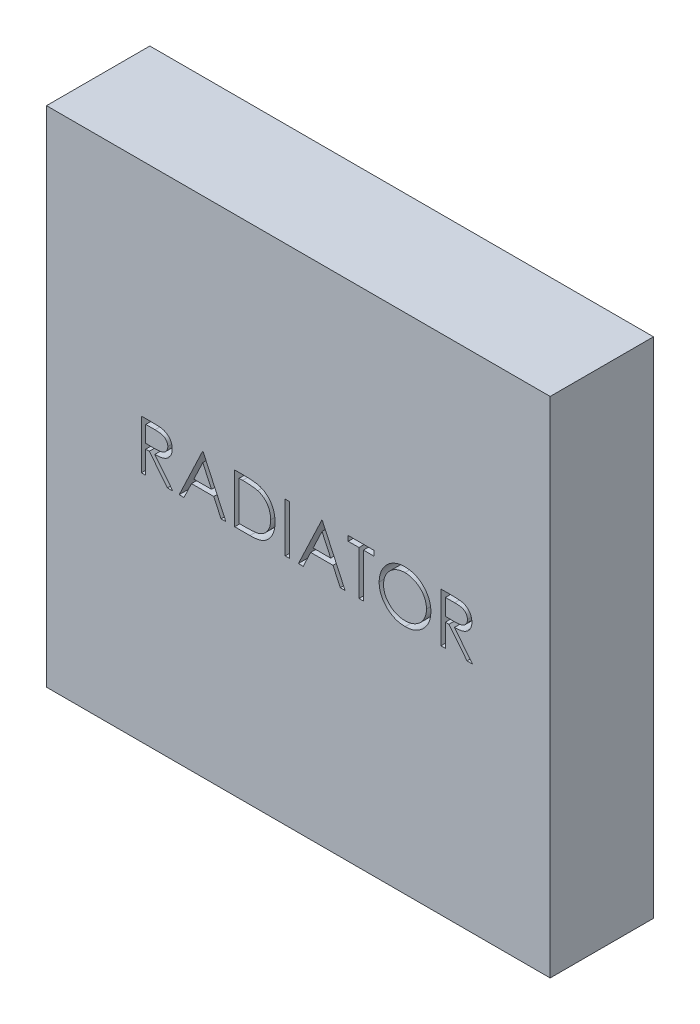
from build123d import *

# Parameters (mm, degrees)
BOSS_EXTRUDE1_DEPTH      = 97.5
BOSS_EXTRUDE1_DEPTH_BACK = 97.5
SKETCH1_W                = 195
SKETCH1_H                = 40
SKETCH2_W                = 1.709615385
SKETCH2_H                = 19.05
CUT_EXTRUDE1_DEPTH       = 15


with BuildPart() as part:
    # Sketch1 → Boss-Extrude1 (new, two sides: drawn at the far end of the back side and taken through both)
    with BuildSketch(Plane(origin=(0, 0, 0), x_dir=(1, 0, 0), z_dir=(0, 1, 0)).offset(-BOSS_EXTRUDE1_DEPTH_BACK)):
        Rectangle(SKETCH1_W, SKETCH1_H)
    extrude(amount=BOSS_EXTRUDE1_DEPTH + BOSS_EXTRUDE1_DEPTH_BACK)

    # Sketch2 → Cut-Extrude1 (cut)
    # profile 1 of 8: a face of its own
    with BuildSketch(Plane.XY.offset(20)):
        with BuildLine():
            Line((-60.79016225, 11.780573711), (-56.977872587, 11.780573711))
            add(Edge.make_bspline(
                [(-56.977872587, 11.780573711), (-56.723467302, 11.779726879), (-56.234980973, 11.778100867), (-55.53517503, 11.769034357), (-54.899301831, 11.743048221), (-54.327693848, 11.720685788), (-53.820361569, 11.679908222), (-53.375749315, 11.640933843), (-52.995904847, 11.589914346), (-52.765966713, 11.542531973), (-52.661856962, 11.521078519)],
                knots=[0, 0, 0, 0, 1.410062039, 2.707475311, 3.878576406, 4.937260626, 5.877586885, 6.699081471, 7.410979367, 8, 8, 8, 8], degree=3))
            add(Edge.make_bspline(
                [(-52.661856962, 11.521078519), (-52.522483765, 11.486642839), (-52.246710579, 11.418506085), (-51.849653791, 11.274490258), (-51.471297257, 11.107832015), (-51.113212641, 10.912086623), (-50.777193549, 10.685801037), (-50.459775315, 10.432881684), (-50.159517578, 10.154712464), (-49.888563277, 9.84427997), (-49.633080724, 9.518598396), (-49.417605486, 9.166425091), (-49.231859932, 8.798153062), (-49.083974689, 8.410036974), (-48.964896005, 8.005840759), (-48.880933188, 7.581903165), (-48.830580295, 7.140155572), (-48.82545391, 6.838850383), (-48.822854558, 6.686072509)],
                knots=[0, 0, 0, 0, 1.027469482, 2.033020251, 3.019912614, 3.986113645, 4.951240523, 5.91722682, 6.890402269, 7.87763091, 8.8651537, 9.85103654, 10.82876324, 11.815024772, 12.821070561, 13.842952187, 14.906261191, 16, 16, 16, 16], degree=3))
            add(Edge.make_bspline(
                [(-48.822854558, 6.686072509), (-48.830850105, 6.432244297), (-48.846451488, 5.936959712), (-48.991912409, 5.2181712), (-49.230181752, 4.547669359), (-49.558512797, 3.92629843), (-49.976630229, 3.366170488), (-50.479140878, 2.874188153), (-51.066325077, 2.462490915), (-51.612947497, 2.176997792), (-52.095806212, 1.994156389), (-52.493316101, 1.865507065), (-52.926932078, 1.766109796), (-53.392499571, 1.677063936), (-53.891956038, 1.609835428), (-54.424104396, 1.560596107), (-54.989324164, 1.529821927), (-55.377612527, 1.525239015), (-55.57736177, 1.522881403)],
                knots=[0, 0, 0, 0, 1.260483769, 2.459530307, 3.627416485, 4.787058657, 5.939039949, 7.08810263, 8.267026773, 9.491475466, 10.141966685, 10.831826277, 11.566392101, 12.351337768, 13.187381173, 14.07005841, 15.007169909, 16, 16, 16, 16], degree=3))
            Line((-55.57736177, 1.522881403), (-48.578623789, -7.269426289))
            Line((-48.578623789, -7.269426289), (-50.692746385, -7.269426289))
            Line((-50.692746385, -7.269426289), (-57.691484366, 1.522881403))
            Line((-57.691484366, 1.522881403), (-59.080546866, 1.522881403))
            Line((-59.080546866, 1.522881403), (-59.080546866, -7.269426289))
            Line((-59.080546866, -7.269426289), (-60.79016225, -7.269426289))
            Line((-60.79016225, -7.269426289), (-60.79016225, 11.780573711))
        make_face()
        with BuildLine():
            Line((-59.080546866, 9.826727557), (-59.080546866, 3.476727557))
            Line((-59.080546866, 3.476727557), (-55.592626193, 3.450014817))
            add(Edge.make_bspline(
                [(-55.592626193, 3.450014817), (-55.429775695, 3.449942772), (-55.114125049, 3.449803127), (-54.657465716, 3.471540681), (-54.232269108, 3.496269313), (-53.840161585, 3.534093608), (-53.480967983, 3.582840227), (-53.154867833, 3.64381647), (-52.861328822, 3.714856982), (-52.518981063, 3.824811546), (-52.136693657, 3.999015731), (-51.721232425, 4.252465088), (-51.367433987, 4.571248436), (-51.068523908, 4.93577539), (-50.828333716, 5.336566973), (-50.658995249, 5.768818925), (-50.551539956, 6.221618909), (-50.538866016, 6.532831182), (-50.532469943, 6.689888615)],
                knots=[0, 0, 0, 0, 1.146690395, 2.22261258, 3.21895312, 4.145990853, 4.996080663, 5.770904154, 6.481378293, 7.121626537, 8.300444488, 9.431385265, 10.535395872, 11.636531494, 12.74115979, 13.810798291, 14.895190096, 16, 16, 16, 16], degree=3))
            add(Edge.make_bspline(
                [(-50.532469943, 6.689888615), (-50.539012916, 6.843086395), (-50.551978702, 7.146668494), (-50.65783557, 7.591109948), (-50.836847775, 8.010574348), (-51.078087384, 8.403355331), (-51.37199707, 8.759893693), (-51.716626879, 9.064950341), (-52.102553727, 9.31667957), (-52.463258393, 9.477539841), (-52.785661749, 9.576163614), (-53.065586042, 9.645566377), (-53.381878513, 9.701325557), (-53.736074938, 9.74600086), (-54.126663243, 9.784399914), (-54.555618358, 9.810263166), (-55.020094262, 9.825578627), (-55.342022559, 9.826335668), (-55.508671866, 9.826727557)],
                knots=[0, 0, 0, 0, 1.101028733, 2.181837193, 3.264309656, 4.369019818, 5.486613113, 6.575447106, 7.666700264, 8.788928104, 9.402425223, 10.0903467, 10.862060571, 11.710948788, 12.657782767, 13.684531032, 14.801375019, 16, 16, 16, 16], degree=3))
            Line((-55.508671866, 9.826727557), (-59.080546866, 9.826727557))
        make_face(mode=Mode.SUBTRACT)
    # profile 2 of 8: a face of its own
    with BuildSketch(Plane.XY.offset(20)):
        Polygon((-36.855546866, 11.780573711), (-28.063239173, -7.269426289), (-29.921682683, -7.269426289), (-32.737968741, -1.163657058), (-41.373816097, -1.163657058), (-44.270240375, -7.269426289), (-46.136316097, -7.269426289), (-37.099777635, 11.780573711), align=None)
        Polygon((-36.996742779, 8.067502798), (-40.446502395, 0.790189096), (-33.638569702, 0.790189096), align=None, mode=Mode.SUBTRACT)
    # profile 3 of 8: a face of its own
    with BuildSketch(Plane.XY.offset(20)):
        with BuildLine():
            Line((-24.644008404, -7.269426289), (-24.644008404, 11.780573711))
            Line((-24.644008404, 11.780573711), (-20.797373789, 11.780573711))
            add(Edge.make_bspline(
                [(-20.797373789, 11.780573711), (-20.462806867, 11.778164866), (-19.816425316, 11.773510989), (-18.882363281, 11.744003132), (-18.018125945, 11.691803596), (-17.226555669, 11.615769461), (-16.505479358, 11.522407949), (-15.856916077, 11.40538432), (-15.277512271, 11.267200136), (-14.921171458, 11.149387042), (-14.75266225, 11.093674673)],
                knots=[0, 0, 0, 0, 1.314313732, 2.53924729, 3.670748893, 4.714932338, 5.66265055, 6.526160246, 7.303039223, 8, 8, 8, 8], degree=3))
            add(Edge.make_bspline(
                [(-14.75266225, 11.093674673), (-14.532255169, 11.009687546), (-14.096439108, 10.843617843), (-13.475914627, 10.530347117), (-12.891758009, 10.17540152), (-12.340836663, 9.778313182), (-11.835735022, 9.327838656), (-11.356720613, 8.843113662), (-10.923389045, 8.30651141), (-10.526559605, 7.729160404), (-10.168769801, 7.117861948), (-9.857769528, 6.473780857), (-9.599484221, 5.800188053), (-9.385072516, 5.098956747), (-9.216091083, 4.368545034), (-9.100800855, 3.60810242), (-9.024758753, 2.820634261), (-9.017116702, 2.286284679), (-9.013239173, 2.015159048)],
                knots=[0, 0, 0, 0, 0.984719456, 1.947108742, 2.898477687, 3.838006223, 4.779231079, 5.722358779, 6.681677486, 7.655904652, 8.64651281, 9.637519902, 10.640069247, 11.656948941, 12.698408672, 13.768548281, 14.867775369, 16, 16, 16, 16], degree=3))
            add(Edge.make_bspline(
                [(-9.013239173, 2.015159048), (-9.016662554, 1.779694307), (-9.023408682, 1.315686441), (-9.083983958, 0.631840995), (-9.172029357, -0.031717158), (-9.308341348, -0.671828182), (-9.473817886, -1.29410034), (-9.685894195, -1.891901555), (-9.928838824, -2.470715717), (-10.212138877, -3.022716551), (-10.523151273, -3.54568462), (-10.856916761, -4.03867428), (-11.213079346, -4.494650845), (-11.595035291, -4.914995147), (-11.997848719, -5.29907351), (-12.424156861, -5.650094336), (-12.875059752, -5.961189299), (-13.348537828, -6.244583131), (-13.858403617, -6.491799637), (-14.414314546, -6.700968691), (-15.018641386, -6.874305269), (-15.66990078, -7.018926858), (-16.369217995, -7.133647606), (-17.117278652, -7.210535542), (-17.912933414, -7.26253079), (-18.459283415, -7.267083159), (-18.740492779, -7.269426289)],
                knots=[0, 0, 0, 0, 1.105936401, 2.179363191, 3.223086493, 4.248585256, 5.251745608, 6.245858792, 7.225916811, 8.198733463, 9.158002045, 10.082870192, 10.993790845, 11.873723703, 12.748670949, 13.606408763, 14.465103618, 15.319838547, 16.196477973, 17.123216899, 18.106603292, 19.147568657, 20.255746949, 21.433717677, 22.679120308, 24, 24, 24, 24], degree=3))
            Line((-18.740492779, -7.269426289), (-24.644008404, -7.269426289))
        make_face()
        with BuildLine():
            Line((-22.93439302, -5.315580135), (-20.747764414, -5.315580135))
            add(Edge.make_bspline(
                [(-20.747764414, -5.315580135), (-20.433557139, -5.314229782), (-19.829221479, -5.311632558), (-18.960225808, -5.28884221), (-18.166225093, -5.251602522), (-17.447106592, -5.199486741), (-16.803276331, -5.130533278), (-16.233388778, -5.05365345), (-15.739312015, -4.95787304), (-15.440338937, -4.871054247), (-15.302181481, -4.830934702)],
                knots=[0, 0, 0, 0, 1.375205317, 2.645023457, 3.804390687, 4.853969522, 5.800190428, 6.637939096, 7.370582563, 8, 8, 8, 8], degree=3))
            add(Edge.make_bspline(
                [(-15.302181481, -4.830934702), (-15.12829111, -4.769694078), (-14.784663737, -4.648675561), (-14.290010973, -4.427926005), (-13.828690705, -4.166439883), (-13.392663282, -3.875778934), (-12.988113914, -3.545691409), (-12.610248367, -3.183355027), (-12.259827419, -2.786925751), (-11.940471543, -2.356895615), (-11.654676345, -1.895941156), (-11.40718294, -1.408594075), (-11.190276746, -0.900194151), (-11.020031835, -0.362934302), (-10.886597013, 0.19838243), (-10.792083497, 0.783795534), (-10.733220496, 1.393195682), (-10.726354615, 1.807680816), (-10.722854558, 2.018975153)],
                knots=[0, 0, 0, 0, 0.998632004, 1.973411704, 2.929992603, 3.868527914, 4.809262121, 5.754881198, 6.702106254, 7.672490631, 8.653608572, 9.636854334, 10.631411391, 11.644891563, 12.686317036, 13.754757253, 14.855430412, 16, 16, 16, 16], degree=3))
            add(Edge.make_bspline(
                [(-10.722854558, 2.018975153), (-10.725648308, 2.241770239), (-10.731136654, 2.679453157), (-10.800121115, 3.321659655), (-10.900931296, 3.939318625), (-11.046711073, 4.532471374), (-11.23248057, 5.102275119), (-11.46431712, 5.645578453), (-11.729202577, 6.168119239), (-12.044362167, 6.657836859), (-12.389524183, 7.120986496), (-12.772580926, 7.545283965), (-13.187446593, 7.931695799), (-13.629596273, 8.286239772), (-14.111491056, 8.594652065), (-14.621779002, 8.870532429), (-15.167946155, 9.104661781), (-15.547926685, 9.229188162), (-15.741033645, 9.292472749)],
                knots=[0, 0, 0, 0, 1.122418816, 2.205001699, 3.251619955, 4.274784885, 5.280384055, 6.268708349, 7.249350384, 8.229342522, 9.199999885, 10.157847722, 11.105861043, 12.055065948, 13.010012805, 13.98527497, 14.976112212, 16, 16, 16, 16], degree=3))
            add(Edge.make_bspline(
                [(-15.741033645, 9.292472749), (-15.900787741, 9.336649307), (-16.240468783, 9.430580789), (-16.794766437, 9.533044602), (-17.418600322, 9.623420518), (-18.114740123, 9.699936418), (-18.882392308, 9.754840267), (-19.722147267, 9.796049851), (-20.634367972, 9.823844522), (-21.266732906, 9.825742485), (-21.594939895, 9.826727557)],
                knots=[0, 0, 0, 0, 0.674548936, 1.434276114, 2.292660221, 3.240891867, 4.284742987, 5.42552168, 6.663806718, 8, 8, 8, 8], degree=3))
            Line((-21.594939895, 9.826727557), (-22.93439302, 9.826727557))
            Line((-22.93439302, 9.826727557), (-22.93439302, -5.315580135))
        make_face(mode=Mode.SUBTRACT)
    # profile 4 of 8: a face of its own
    with BuildSketch(Plane.XY.offset(20)):
        with Locations((-4.250739174, 2.255573711)):
            Rectangle(SKETCH2_W, SKETCH2_H)
    # profile 5 of 8: a face of its own
    with BuildSketch(Plane.XY.offset(20)):
        Polygon((9.304068519, 11.780573711), (18.096376211, -7.269426289), (16.237932702, -7.269426289), (13.421646644, -1.163657058), (4.785799288, -1.163657058), (1.889375009, -7.269426289), (0.023299288, -7.269426289), (9.05983775, 11.780573711), align=None)
        Polygon((9.162872605, 8.067502798), (5.71311299, 0.790189096), (12.521045682, 0.790189096), align=None, mode=Mode.SUBTRACT)
    # profile 6 of 8: a face of its own
    with BuildSketch(Plane.XY.offset(20)):
        Polygon((19.317530057, 9.826727557), (19.317530057, 11.780573711), (29.330991596, 11.780573711), (29.330991596, 9.826727557), (25.179068519, 9.826727557), (25.179068519, -7.269426289), (23.469453134, -7.269426289), (23.469453134, 9.826727557), align=None)
    # profile 7 of 8: a face of its own
    with BuildSketch(Plane.XY.offset(20)):
        with BuildLine():
            add(Edge.make_bspline(
                [(41.176183903, 12.269035249), (41.528925166, 12.260100912), (42.221738107, 12.242553135), (43.239960051, 12.1082283), (44.212027641, 11.875843392), (45.145859396, 11.566346302), (46.030285454, 11.153481718), (46.871962855, 10.654452554), (47.668888982, 10.064030685), (48.410322502, 9.386780179), (49.088812474, 8.64990738), (49.686579084, 7.863534755), (50.187552139, 7.032416989), (50.598954781, 6.15905161), (50.921708642, 5.245413785), (51.144425152, 4.286632713), (51.286691369, 3.288920585), (51.303323529, 2.608417221), (51.311760827, 2.263205923)],
                knots=[0, 0, 0, 0, 1.065120563, 2.091984664, 3.0946048, 4.079830382, 5.057816894, 6.036188127, 7.030412546, 8.04752943, 9.064399622, 10.05169764, 11.02544977, 11.989514704, 12.962713494, 13.945757189, 14.957906945, 16, 16, 16, 16], degree=3))
            add(Edge.make_bspline(
                [(51.311760827, 2.263205923), (51.303324765, 1.920537536), (51.286696311, 1.245098448), (51.144263393, 0.253717701), (50.920883093, -0.699275947), (50.601951988, -1.612291571), (50.192510455, -2.486292311), (49.688201595, -3.318978446), (49.094161576, -4.110622958), (48.41812143, -4.852553322), (47.681152901, -5.532896698), (46.890685306, -6.125726579), (46.064495951, -6.6358536), (45.19195311, -7.042890454), (44.284628624, -7.368220478), (43.33440198, -7.590031221), (42.345725736, -7.733107842), (41.671513558, -7.749537193), (41.328828134, -7.757887827)],
                knots=[0, 0, 0, 0, 1.043624062, 2.057103931, 3.04512605, 4.022047818, 4.998200453, 5.980619268, 6.982898556, 8.009068085, 9.034988726, 10.034168286, 11.015286542, 11.987931943, 12.962482838, 13.94673481, 14.956375938, 16, 16, 16, 16], degree=3))
            add(Edge.make_bspline(
                [(41.328828134, -7.757887827), (40.983618627, -7.749454736), (40.303118794, -7.732830868), (39.30415293, -7.590329222), (38.344698353, -7.367491554), (37.427498813, -7.049033052), (36.552042839, -6.637459267), (35.716618246, -6.135604004), (34.924578316, -5.540116564), (34.182489667, -4.864295637), (33.503497603, -4.128576189), (32.911535858, -3.34026403), (32.409567741, -2.514825044), (31.999375889, -1.64996852), (31.67463076, -0.749875382), (31.45308025, 0.191458474), (31.309737425, 1.168666356), (31.293219189, 1.834016988), (31.28483775, 2.171619384)],
                knots=[0, 0, 0, 0, 1.053102029, 2.075944431, 3.073151272, 4.055350789, 5.033113405, 6.020478099, 7.024410459, 8.052272461, 9.079885166, 10.07527673, 11.055994387, 12.023226415, 12.992069828, 13.970394897, 14.97016774, 16, 16, 16, 16], degree=3))
            add(Edge.make_bspline(
                [(31.28483775, 2.171619384), (31.287747694, 2.398220055), (31.293530873, 2.848562727), (31.363154228, 3.517308079), (31.464182916, 4.175298659), (31.608973326, 4.82066339), (31.798339399, 5.451822464), (32.02177972, 6.073128759), (32.294683735, 6.678285884), (32.603188405, 7.27016063), (32.947513389, 7.839526518), (33.327837111, 8.377713963), (33.730801045, 8.889239103), (34.172561802, 9.360846367), (34.638559882, 9.806255268), (35.136354768, 10.218620913), (35.662908984, 10.601661718), (36.220488223, 10.946849574), (36.795353405, 11.25904715), (37.387954152, 11.526954653), (37.990242063, 11.756893931), (38.605038075, 11.943261851), (39.230709592, 12.090393361), (39.868622162, 12.190581957), (40.518267582, 12.260382888), (40.955934904, 12.26613872), (41.176183903, 12.269035249)],
                knots=[0, 0, 0, 0, 1.037015668, 2.060948919, 3.074880161, 4.083647147, 5.086022904, 6.090072063, 7.104153813, 8.122640571, 9.144368836, 10.147691507, 11.138137339, 12.123020368, 13.103399296, 14.087645067, 15.080126199, 16.082011238, 17.087798457, 18.072939717, 19.057185487, 20.037253025, 21.01195951, 21.997135196, 22.992090687, 24, 24, 24, 24], degree=3))
        make_face()
        with BuildLine():
            add(Edge.make_bspline(
                [(41.26013823, 10.315189096), (41.079355725, 10.312985336), (40.719519007, 10.308598884), (40.184570317, 10.250819061), (39.656657077, 10.168469237), (39.135670263, 10.051004102), (38.623789745, 9.890962044), (38.116244181, 9.706770815), (37.617661845, 9.482410307), (37.129688704, 9.228921731), (36.656622367, 8.948348319), (36.210238949, 8.63825913), (35.789382844, 8.305926142), (35.395084492, 7.95057377), (35.028501684, 7.570392366), (34.682419237, 7.171145535), (34.370709086, 6.741421671), (34.085037589, 6.292873599), (33.829398344, 5.826085564), (33.602075485, 5.345971885), (33.416125666, 4.84861619), (33.264474732, 4.339414275), (33.138745761, 3.819172602), (33.059095403, 3.283944625), (33.000680704, 2.736419801), (32.996544974, 2.366404281), (32.994453134, 2.179251596)],
                knots=[0, 0, 0, 0, 1.008559885, 2.007477868, 2.99961109, 3.989939068, 4.984837346, 5.991145699, 7.001802488, 8.033829008, 9.059044045, 10.069351652, 11.065060232, 12.050310815, 13.029377138, 14.011219647, 14.996725999, 15.989392538, 16.977580475, 17.965360261, 18.951710183, 19.937753436, 20.929683414, 21.935841486, 22.955955122, 24, 24, 24, 24], degree=3))
            add(Edge.make_bspline(
                [(32.994453134, 2.179251596), (33.001392026, 1.904048651), (33.015042972, 1.362639322), (33.134554889, 0.569244139), (33.318643065, -0.193236391), (33.590009588, -0.920630212), (33.929375076, -1.619189808), (34.348621436, -2.282718207), (34.845331602, -2.911394737), (35.409557368, -3.500830415), (36.026356671, -4.038834007), (36.681310529, -4.511074846), (37.367402307, -4.910636348), (38.086421168, -5.236146814), (38.834528487, -5.494082386), (39.616544872, -5.670858936), (40.427260945, -5.787202486), (40.979877797, -5.798375343), (41.26013823, -5.804041674)],
                knots=[0, 0, 0, 0, 1.032063989, 2.030389145, 3.003944642, 3.970395727, 4.937377036, 5.913328081, 6.909231446, 7.93887556, 8.970685674, 9.976071282, 10.964166581, 11.944589148, 12.933237628, 13.927779006, 14.949070134, 16, 16, 16, 16], degree=3))
            add(Edge.make_bspline(
                [(41.26013823, -5.804041674), (41.448512803, -5.801453571), (41.822116159, -5.796320587), (42.377807502, -5.744620646), (42.92348774, -5.661715757), (43.458391492, -5.542350331), (43.981911679, -5.392959108), (44.496233393, -5.215479903), (44.995878374, -4.994057923), (45.487149777, -4.749412643), (45.957392178, -4.470519786), (46.406294718, -4.170955), (46.822542551, -3.839111507), (47.216545925, -3.489038842), (47.584633776, -3.11367847), (47.924316961, -2.713518405), (48.23445168, -2.286032828), (48.5200147, -1.83816512), (48.774758173, -1.370099801), (48.996712983, -0.888245411), (49.185014699, -0.393788459), (49.337025561, 0.113984237), (49.456145003, 0.634108286), (49.538222853, 1.167280111), (49.595636497, 1.712433104), (49.599963989, 2.081153234), (49.602145442, 2.267022028)],
                knots=[0, 0, 0, 0, 1.047197238, 2.076906641, 3.100256066, 4.114471768, 5.12198147, 6.126382909, 7.136867548, 8.15857795, 9.17633901, 10.174870724, 11.156907918, 12.133735059, 13.104061851, 14.077631395, 15.04955518, 16.038496417, 17.029181396, 18.010275684, 18.986308667, 19.968651475, 20.955262928, 21.950658345, 22.966943676, 24, 24, 24, 24], degree=3))
            add(Edge.make_bspline(
                [(49.602145442, 2.267022028), (49.599962241, 2.451619273), (49.595631461, 2.817801912), (49.538250277, 3.359152937), (49.456058288, 3.888488274), (49.337606977, 4.40372983), (49.184933998, 4.905008945), (48.9966801, 5.391854815), (48.774691541, 5.866081134), (48.519921063, 6.326515808), (48.233540652, 6.76833831), (47.920607699, 7.190717155), (47.575719161, 7.585720219), (47.20872894, 7.963099054), (46.810470264, 8.314804996), (46.382747178, 8.640954715), (45.930752303, 8.949419251), (45.452176922, 9.22768838), (44.958270545, 9.484668704), (44.451464574, 9.704837736), (43.937500475, 9.891920271), (43.417685235, 10.051488324), (42.887643595, 10.168009174), (42.350957041, 10.250893273), (41.808368091, 10.308578774), (41.443461424, 10.312978663), (41.26013823, 10.315189096)],
                knots=[0, 0, 0, 0, 1.02996197, 2.043119294, 3.035359645, 4.018872909, 4.991431989, 5.957985074, 6.929999688, 7.912076566, 8.892894881, 9.867085534, 10.843653904, 11.817741046, 12.803660682, 13.806313499, 14.818574707, 15.856120519, 16.894564902, 17.924820532, 18.937903209, 19.946497019, 20.957711757, 21.963978472, 22.977135795, 24, 24, 24, 24], degree=3))
        make_face(mode=Mode.SUBTRACT)
    # profile 8 of 8: a face of its own
    with BuildSketch(Plane.XY.offset(20)):
        with BuildLine():
            Line((55.219453134, 11.780573711), (59.031742798, 11.780573711))
            add(Edge.make_bspline(
                [(59.031742798, 11.780573711), (59.286148083, 11.779726879), (59.774634412, 11.778100867), (60.474440355, 11.769034357), (61.110313554, 11.743048221), (61.681921537, 11.720685788), (62.189253816, 11.679908222), (62.63386607, 11.640933843), (63.013710538, 11.589914346), (63.243648671, 11.542531973), (63.347758423, 11.521078519)],
                knots=[0, 0, 0, 0, 1.410062039, 2.707475311, 3.878576406, 4.937260626, 5.877586885, 6.699081471, 7.410979367, 8, 8, 8, 8], degree=3))
            add(Edge.make_bspline(
                [(63.347758423, 11.521078519), (63.48713162, 11.486642839), (63.762904805, 11.418506085), (64.159961593, 11.274490258), (64.538318128, 11.107832015), (64.896402743, 10.912086623), (65.232421835, 10.685801037), (65.54984007, 10.432881684), (65.850097806, 10.154712464), (66.121052108, 9.84427997), (66.37653466, 9.518598396), (66.592009899, 9.166425091), (66.777755453, 8.798153062), (66.925640695, 8.410036974), (67.04471938, 8.005840759), (67.128682197, 7.581903165), (67.179035089, 7.140155572), (67.184161475, 6.838850383), (67.186760827, 6.686072509)],
                knots=[0, 0, 0, 0, 1.027469482, 2.033020251, 3.019912614, 3.986113645, 4.951240523, 5.91722682, 6.890402269, 7.87763091, 8.8651537, 9.85103654, 10.82876324, 11.815024772, 12.821070561, 13.842952187, 14.906261191, 16, 16, 16, 16], degree=3))
            add(Edge.make_bspline(
                [(67.186760827, 6.686072509), (67.17876528, 6.432244297), (67.163163897, 5.936959712), (67.017702975, 5.2181712), (66.779433632, 4.547669359), (66.451102588, 3.92629843), (66.032985156, 3.366170488), (65.530474507, 2.874188153), (64.943290307, 2.462490915), (64.396667888, 2.176997792), (63.913809172, 1.994156389), (63.516299284, 1.865507065), (63.082683307, 1.766109796), (62.617115814, 1.677063936), (62.117659346, 1.609835428), (61.585510989, 1.560596107), (61.020291221, 1.529821927), (60.632002858, 1.525239015), (60.432253615, 1.522881403)],
                knots=[0, 0, 0, 0, 1.260483769, 2.459530307, 3.627416485, 4.787058657, 5.939039949, 7.08810263, 8.267026773, 9.491475466, 10.141966685, 10.831826277, 11.566392101, 12.351337768, 13.187381173, 14.07005841, 15.007169909, 16, 16, 16, 16], degree=3))
            Line((60.432253615, 1.522881403), (67.430991596, -7.269426289))
            Line((67.430991596, -7.269426289), (65.316869, -7.269426289))
            Line((65.316869, -7.269426289), (58.318131019, 1.522881403))
            Line((58.318131019, 1.522881403), (56.929068519, 1.522881403))
            Line((56.929068519, 1.522881403), (56.929068519, -7.269426289))
            Line((56.929068519, -7.269426289), (55.219453134, -7.269426289))
            Line((55.219453134, -7.269426289), (55.219453134, 11.780573711))
        make_face()
        with BuildLine():
            Line((56.929068519, 9.826727557), (56.929068519, 3.476727557))
            Line((56.929068519, 3.476727557), (60.416989192, 3.450014817))
            add(Edge.make_bspline(
                [(60.416989192, 3.450014817), (60.579839689, 3.449942772), (60.895490336, 3.449803127), (61.352149669, 3.471540681), (61.777346277, 3.496269313), (62.169453799, 3.534093608), (62.528647402, 3.582840227), (62.854747551, 3.64381647), (63.148286562, 3.714856982), (63.490634321, 3.824811546), (63.872921728, 3.999015731), (64.288382959, 4.252465088), (64.642181398, 4.571248436), (64.941091477, 4.93577539), (65.181281668, 5.336566973), (65.350620135, 5.768818925), (65.458075428, 6.221618909), (65.470749369, 6.532831182), (65.477145442, 6.689888615)],
                knots=[0, 0, 0, 0, 1.146690395, 2.22261258, 3.21895312, 4.145990853, 4.996080663, 5.770904154, 6.481378293, 7.121626537, 8.300444488, 9.431385265, 10.535395872, 11.636531494, 12.74115979, 13.810798291, 14.895190096, 16, 16, 16, 16], degree=3))
            add(Edge.make_bspline(
                [(65.477145442, 6.689888615), (65.470602469, 6.843086395), (65.457636683, 7.146668494), (65.351779814, 7.591109948), (65.17276761, 8.010574348), (64.931528001, 8.403355331), (64.637618314, 8.759893693), (64.292988505, 9.064950341), (63.907061657, 9.31667957), (63.546356992, 9.477539841), (63.223953635, 9.576163614), (62.944029343, 9.645566377), (62.627736871, 9.701325557), (62.273540447, 9.74600086), (61.882952142, 9.784399914), (61.453997027, 9.810263166), (60.989521123, 9.825578627), (60.667592826, 9.826335668), (60.500943519, 9.826727557)],
                knots=[0, 0, 0, 0, 1.101028733, 2.181837193, 3.264309656, 4.369019818, 5.486613113, 6.575447106, 7.666700264, 8.788928104, 9.402425223, 10.0903467, 10.862060571, 11.710948788, 12.657782767, 13.684531032, 14.801375019, 16, 16, 16, 16], degree=3))
            Line((60.500943519, 9.826727557), (56.929068519, 9.826727557))
        make_face(mode=Mode.SUBTRACT)
    extrude(amount=-CUT_EXTRUDE1_DEPTH, mode=Mode.SUBTRACT)


solid = part.part
